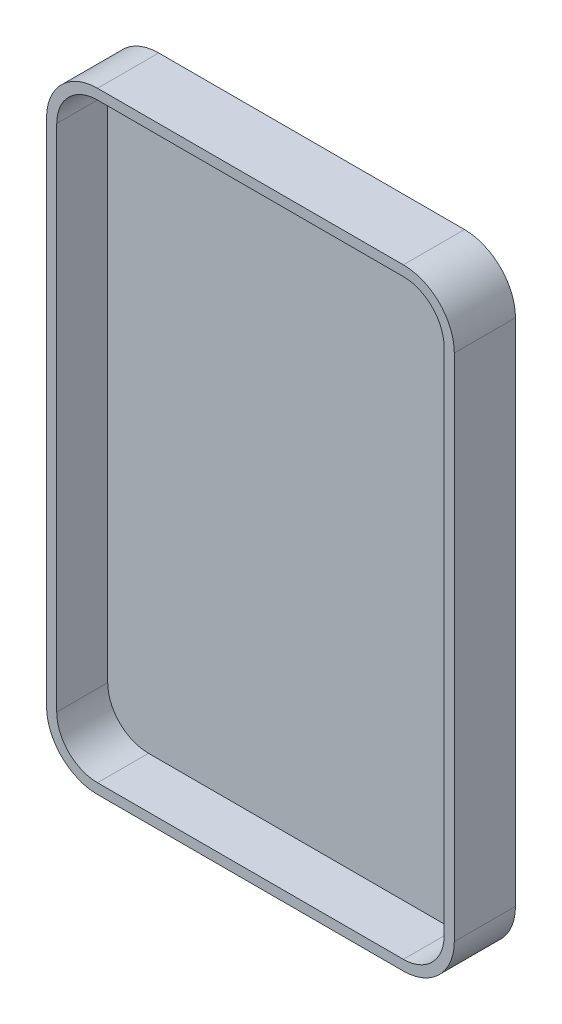
from build123d import *

# Parameters (mm, degrees)
BOSS_EXTRU_3_DEPTH = 2
BOSS_EXTRU_4_DEPTH = 10


with BuildPart() as part:
    # Esquisse1 → Boss.-Extru.3 (new body)
    with BuildSketch(Plane.XY):
        with BuildLine():
            Line((-70, 0), (-10.000000065, 0))
            ThreePointArc((-10.000000065, 0), (-2.928932211, 2.928932165), (0, 10))
            Line((0, 10), (0, 110))
            ThreePointArc((0, 110), (-2.928932188, 117.071067812), (-10, 120))
            Line((-10, 120), (-70, 120))
            ThreePointArc((-70, 120), (-77.071067812, 117.071067812), (-80, 110))
            Line((-80, 110), (-80, 10))
            ThreePointArc((-80, 10), (-77.071067812, 2.928932188), (-70, 0))
        make_face()
    extrude(amount=BOSS_EXTRU_3_DEPTH)

    # Esquisse3 → Boss.-Extru.4 (add)
    with BuildSketch(Plane.XY.offset(2)):
        with BuildLine():
            ThreePointArc((-80, 10), (-79.486832981, 6.83772234), (-78, 4))
            Line((-78, 4), (-78, 10))
            Line((-78, 10), (-78, 16))
            ThreePointArc((-78, 16), (-79.486832981, 13.16227766), (-80, 10))
        make_face()
        with BuildLine():
            ThreePointArc((-78, 4), (-77.071067812, 2.928932188), (-76, 2))
            Line((-76, 2), (-70, 2))
            ThreePointArc((-70, 2), (-75.656854249, 4.343145751), (-78, 10))
            Line((-78, 10), (-78, 4))
        make_face()
        with BuildLine():
            ThreePointArc((-76, 2), (-73.16227766, 0.513167019), (-70, 0))
            ThreePointArc((-70, 0), (-66.83772234, 0.513167019), (-64, 2))
            Line((-64, 2), (-70, 2))
            Line((-70, 2), (-76, 2))
        make_face()
        with BuildLine():
            Line((-70, 0), (-10, 0))
            ThreePointArc((-10, 0), (-13.16227766, 0.513167019), (-16, 2))
            Line((-16, 2), (-64, 2))
            ThreePointArc((-64, 2), (-66.83772234, 0.513167019), (-70, 0))
        make_face()
        with BuildLine():
            ThreePointArc((-80, 10), (-79.486832981, 13.16227766), (-78, 16))
            Line((-78, 16), (-78, 104))
            ThreePointArc((-78, 104), (-79.486832981, 106.83772234), (-80, 110))
            Line((-80, 110), (-80, 10))
        make_face()
        with BuildLine():
            ThreePointArc((-80, 110), (-79.486832981, 106.83772234), (-78, 104))
            Line((-78, 104), (-78, 110))
            Line((-78, 110), (-78, 116))
            ThreePointArc((-78, 116), (-79.486832981, 113.16227766), (-80, 110))
        make_face()
        with BuildLine():
            ThreePointArc((-78, 110), (-75.656854249, 115.656854249), (-70, 118))
            Line((-70, 118), (-76, 118))
            ThreePointArc((-76, 118), (-77.071067812, 117.071067812), (-78, 116))
            Line((-78, 116), (-78, 110))
        make_face()
        with BuildLine():
            Line((-70, 118), (-64, 118))
            ThreePointArc((-64, 118), (-66.83772234, 119.486832981), (-70, 120))
            ThreePointArc((-70, 120), (-73.16227766, 119.486832981), (-76, 118))
            Line((-76, 118), (-70, 118))
        make_face()
        with BuildLine():
            Line((-64, 118), (-16, 118))
            ThreePointArc((-16, 118), (-13.16227766, 119.486832981), (-10, 120))
            Line((-10, 120), (-70, 120))
            ThreePointArc((-70, 120), (-66.83772234, 119.486832981), (-64, 118))
        make_face()
        with BuildLine():
            ThreePointArc((-10, 120), (-13.16227766, 119.486832981), (-16, 118))
            Line((-16, 118), (-10, 118))
            Line((-10, 118), (-4, 118))
            ThreePointArc((-4, 118), (-6.83772234, 119.486832981), (-10, 120))
        make_face()
        with BuildLine():
            Line((-2, 110), (-2, 116))
            ThreePointArc((-2, 116), (-2.928932188, 117.071067812), (-4, 118))
            Line((-4, 118), (-10, 118))
            ThreePointArc((-10, 118), (-4.343145751, 115.656854249), (-2, 110))
        make_face()
        with BuildLine():
            ThreePointArc((-2, 104), (-0.513167019, 106.83772234), (0, 110))
            ThreePointArc((0, 110), (-0.513167019, 113.16227766), (-2, 116))
            Line((-2, 116), (-2, 110))
            Line((-2, 110), (-2, 104))
        make_face()
        with BuildLine():
            ThreePointArc((-2, 16), (-0.513167019, 13.16227766), (0, 10))
            Line((0, 10), (0, 110))
            ThreePointArc((0, 110), (-0.513167019, 106.83772234), (-2, 104))
            Line((-2, 104), (-2, 16))
        make_face()
        with BuildLine():
            Line((-2, 10), (-2, 4))
            ThreePointArc((-2, 4), (-0.513167019, 6.83772234), (0, 10))
            ThreePointArc((0, 10), (-0.513167019, 13.16227766), (-2, 16))
            Line((-2, 16), (-2, 10))
        make_face()
        with BuildLine():
            Line((-10, 2), (-4, 2))
            ThreePointArc((-4, 2), (-2.928932188, 2.928932188), (-2, 4))
            Line((-2, 4), (-2, 10))
            ThreePointArc((-2, 10), (-4.343145751, 4.343145751), (-10, 2))
        make_face()
        with BuildLine():
            ThreePointArc((-10, 0), (-6.83772234, 0.513167019), (-4, 2))
            Line((-4, 2), (-10, 2))
            Line((-10, 2), (-16, 2))
            ThreePointArc((-16, 2), (-13.16227766, 0.513167019), (-10, 0))
        make_face()
    extrude(amount=BOSS_EXTRU_4_DEPTH)


solid = part.part
